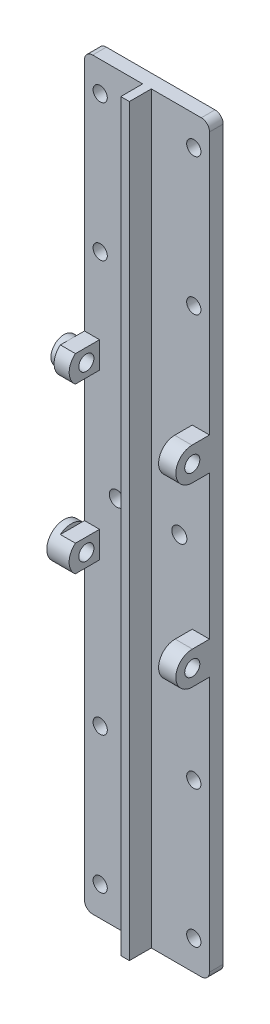
from build123d import *

# Parameters (mm, degrees)
SKETCH1_R           = 1.65
BOSS_EXTRUDE1_DEPTH = 3.175
SKETCH2_W           = 1
SKETCH2_H           = 172.53
BOSS_EXTRUDE2_DEPTH = 5.08
SKETCH4_R           = 1.75
BOSS_EXTRUDE3_DEPTH = 3.5
BOSS_EXTRUDE4_START = 1.6764
SKETCH5_R           = 3.048
SKETCH5_R_2         = 1.75
SKETCH5_R_3         = 3.998686497
BOSS_EXTRUDE4_DEPTH = 1.6764
SKETCH6_R           = 1.75
BOSS_EXTRUDE5_DEPTH = 4
SKETCH7_R           = 1.75
CUT_EXTRUDE1_DEPTH  = 4.54
SKETCH8_R           = 1.75
CUT_EXTRUDE2_DEPTH  = 162.599778233


with BuildPart() as part:
    # Sketch1 → Boss-Extrude1 (new body)
    with BuildSketch(Plane.XY):
        with BuildLine():
            Line((13.6, 160.665), (-11.6, 160.665))
            ThreePointArc((-11.6, 160.665), (-12.943502884, 160.108502884), (-13.5, 158.765))
            Line((-13.5, 158.765), (-13.5, -9.965))
            ThreePointArc((-13.5, -9.965), (-12.943502884, -11.308502884), (-11.6, -11.865))
            Line((-11.6, -11.865), (13.6, -11.865))
            ThreePointArc((13.6, -11.865), (14.943502884, -11.308502884), (15.5, -9.965))
            Line((15.5, -9.965), (15.5, 158.765))
            ThreePointArc((15.5, 158.765), (14.943502884, 160.108502884), (13.6, 160.665))
        make_face()
        with Locations(Location((-9.85, -4.975, 0), (0, 0, 180))):
            Circle(SKETCH1_R, mode=Mode.SUBTRACT)
        with Locations(Location((-9.85, 26.775, 0), (0, 0, 180))):
            Circle(SKETCH1_R, mode=Mode.SUBTRACT)
        with Locations(Location((11.85, -4.975, 0), (0, 0, 180))):
            Circle(SKETCH1_R, mode=Mode.SUBTRACT)
        with Locations(Location((11.85, 26.775, 0), (0, 0, 180))):
            Circle(SKETCH1_R, mode=Mode.SUBTRACT)
        with Locations(Location((-9.85, 122.025, 0), (0, 0, 180))):
            Circle(SKETCH1_R, mode=Mode.SUBTRACT)
        with Locations(Location((-9.85, 153.775, 0), (0, 0, 180))):
            Circle(SKETCH1_R, mode=Mode.SUBTRACT)
        with Locations(Location((11.85, 122.025, 0), (0, 0, 180))):
            Circle(SKETCH1_R, mode=Mode.SUBTRACT)
        with Locations(Location((11.85, 153.775, 0), (0, 0, 180))):
            Circle(SKETCH1_R, mode=Mode.SUBTRACT)
    extrude(amount=BOSS_EXTRUDE1_DEPTH)

    # Sketch2 → Boss-Extrude2 (add)
    with BuildSketch(Plane.XY.offset(3.175)):
        with Locations((1.5, 74.4)):
            Rectangle(SKETCH2_W, SKETCH2_H)
        with Locations((0.5, 74.4)):
            Rectangle(SKETCH2_W, SKETCH2_H)
    extrude(amount=BOSS_EXTRUDE2_DEPTH)

    # Sketch4 → Boss-Extrude3 (add)
    # profile 1 of 2: a face of its own
    with BuildSketch(Plane.ZY.offset(13.5)):
        with BuildLine():
            Line((8.82313313, 60.076784691), (3.175, 60.076784691))
            Line((3.175, 60.076784691), (3.175, 66.220321271))
            Line((3.175, 66.220321271), (8.765152639, 66.220321271))
            ThreePointArc((8.765152639, 66.220321271), (10.232903429, 63.162131486), (8.82313313, 60.076784691))
        make_face()
        with Locations((6.234395, 63.124395)):
            Circle(SKETCH4_R, mode=Mode.SUBTRACT)
    # profile 2 of 2: a face of its own
    with BuildSketch(Plane.ZY.offset(13.5)):
        with BuildLine():
            Line((8.799348167, 98.176497144), (3.175, 98.176497144))
            Line((3.175, 98.176497144), (3.175, 104.29693575))
            Line((3.175, 104.29693575), (8.769776515, 104.29693575))
            ThreePointArc((8.769776515, 104.29693575), (10.217897937, 101.243641784), (8.799348167, 98.176497144))
        make_face()
        with Locations((6.234395, 101.224395)):
            Circle(SKETCH4_R, mode=Mode.SUBTRACT)
    extrude(amount=-BOSS_EXTRUDE3_DEPTH)

    # Sketch5 → Boss-Extrude4 (add)
    # profile 1 of 2: a face of its own
    with BuildSketch(Plane.ZY.offset(13.5).offset(BOSS_EXTRUDE4_START)):
        with Locations(Location((6.234395, 101.224395, 0), (0, 0, 269.530929423))):
            Circle(SKETCH5_R)
        with Locations((6.234395, 101.224395)):
            Circle(SKETCH5_R_2, mode=Mode.SUBTRACT)
    # profile 2 of 2: a face of its own
    with BuildSketch(Plane.ZY.offset(13.5).offset(BOSS_EXTRUDE4_START)):
        with Locations((6.234395, 63.124395)):
            Circle(SKETCH5_R_3)
        with Locations((6.234395, 63.124395)):
            Circle(SKETCH5_R_2, mode=Mode.SUBTRACT)
    extrude(amount=-BOSS_EXTRUDE4_DEPTH)

    # Sketch6 → Boss-Extrude5 (add)
    # profile 1 of 2: a face of its own
    with BuildSketch(Plane.ZY.offset(-15.5)):
        with BuildLine():
            Line((7.145936701, 56.909889149), (3.175, 56.909889149))
            Line((3.175, 56.909889149), (3.175, 49.290110851))
            Line((3.175, 49.290110851), (7.204063299, 49.290110851))
            ThreePointArc((7.204063299, 49.290110851), (10.984889149, 53.129063299), (7.145936701, 56.909889149))
        make_face()
        with Locations((7.175, 53.1)):
            Circle(SKETCH6_R, mode=Mode.SUBTRACT)
    # profile 2 of 2: a face of its own
    with BuildSketch(Plane.ZY.offset(-15.5)):
        with BuildLine():
            Line((7.267081375, 97.90888711), (3.175, 97.90888711))
            Line((3.175, 97.90888711), (3.175, 90.29111289))
            Line((3.175, 90.29111289), (7.082918625, 90.29111289))
            ThreePointArc((7.082918625, 90.29111289), (10.98388711, 94.007918625), (7.267081375, 97.90888711))
        make_face()
        with Locations((7.175, 94.1)):
            Circle(SKETCH6_R, mode=Mode.SUBTRACT)
    extrude(amount=BOSS_EXTRUDE5_DEPTH)

    # Sketch7 → Cut-Extrude1 (cut)
    with BuildSketch(Plane.XY.offset(3.175)):
        with Locations((8.5, 74.4)):
            Circle(SKETCH7_R)
    extrude(amount=-CUT_EXTRUDE1_DEPTH, mode=Mode.SUBTRACT)

    # Sketch8 → Cut-Extrude2 (cut, through all)
    with BuildSketch(Plane.XY.offset(3.175)):
        with Locations((-6, 74.4)):
            Circle(SKETCH8_R)
    extrude(amount=-CUT_EXTRUDE2_DEPTH, mode=Mode.SUBTRACT)


solid = part.part
